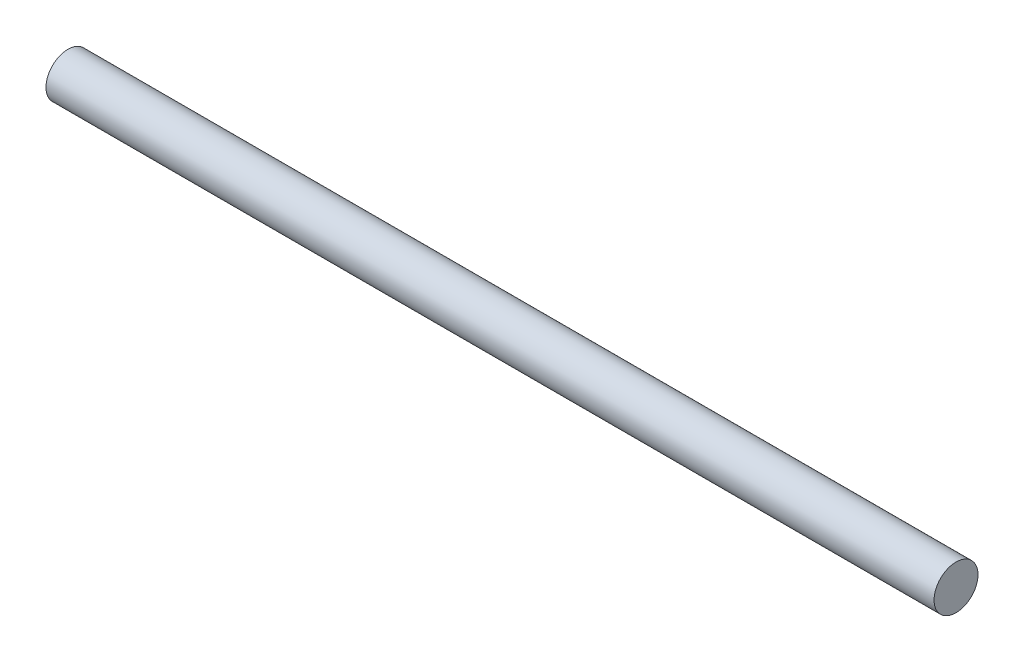
from build123d import *

# Parameters (mm, degrees)
ESQUISSE1_R        = 2.5
BOSS_EXTRU_1_DEPTH = 101


with BuildPart() as part:
    # Esquisse1 → Boss.-Extru.1 (new body)
    with BuildSketch(Plane(origin=(0, 0, 0), x_dir=(0, 0, -1), z_dir=(1, 0, 0))):
        Circle(ESQUISSE1_R)
    extrude(amount=BOSS_EXTRU_1_DEPTH)


solid = part.part
